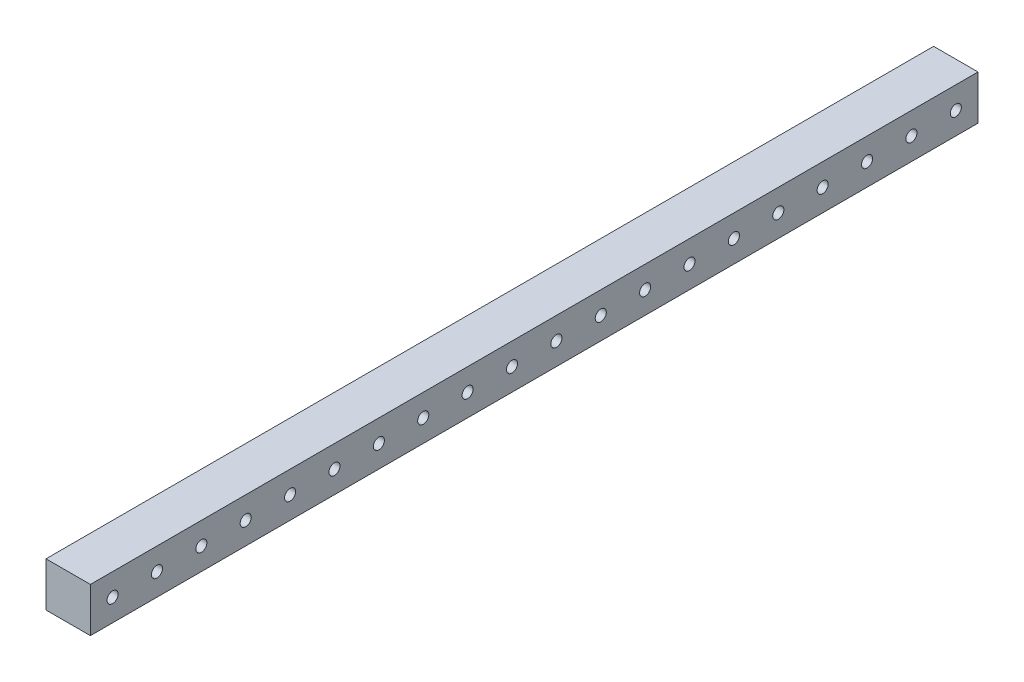
from build123d import *

# Parameters (mm, degrees)
SKETCH1_W             = 20
SKETCH1_H             = 20
BOSS_EXTRUDE1_DEPTH   = 400
F_5_0MM_DOWEL_HOLE1_D = 5
LPATTERN2_COUNT       = 20
LPATTERN2_PITCH       = 20


with BuildPart() as part:
    # Sketch1 → Boss-Extrude1 (new body)
    with BuildSketch(Plane.XY):
        Rectangle(SKETCH1_W, SKETCH1_H)
    extrude(amount=BOSS_EXTRUDE1_DEPTH)

    # Ø5.0mm Dowel Hole1 (through all)
    with Locations(Plane(origin=(10, 0, 0), x_dir=(0, 0, -1), z_dir=(1, 0, 0))):
        with Locations((-10, 0)):
            f_5_0mm_dowel_hole1 = Hole(F_5_0MM_DOWEL_HOLE1_D / 2)

    # LPattern2: Ø5.0mm Dowel Hole1 ×20
    with Locations(*[(0, 0, i * LPATTERN2_PITCH) for i in range(1, LPATTERN2_COUNT)]):
        add(f_5_0mm_dowel_hole1, mode=Mode.SUBTRACT)


solid = part.part
